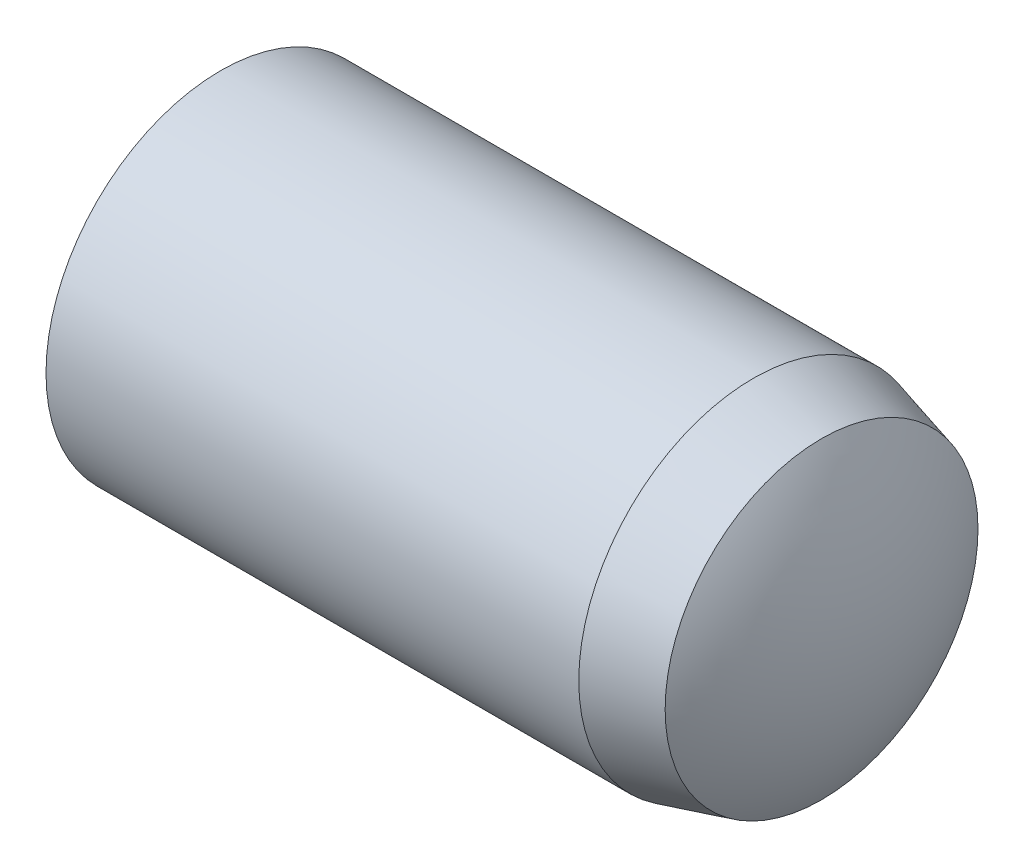
from build123d import *

# Parameters (mm, degrees)
EXTRUDE1_DEPTH      = 3
EXTRUDE1_DEPTH_BACK = 3
SKETCH2_R           = 1.5


with BuildPart() as part:
    # Sketch2 → Extrude1 (new, two sides: drawn at the far end of the back side and taken through both)
    with BuildSketch(Plane(origin=(0, 0, 0), x_dir=(0, 0, -1), z_dir=(1, 0, 0)).offset(-EXTRUDE1_DEPTH_BACK)):
        Circle(SKETCH2_R)
    extrude(amount=EXTRUDE1_DEPTH + EXTRUDE1_DEPTH_BACK)

    # Sketch5 → Cut-Revolve1 (revolve, cut)
    with BuildSketch(Plane.XY, mode=Mode.PRIVATE) as cut_revolve1_sk:
        with BuildLine():
            Line((2.025, 1.5), (2.025, 2))
            Line((2.025, 2), (3.5, 2))
            Line((3.5, 2), (3.5, 0))
            Line((3.5, 0), (3, 0))
            ThreePointArc((3, 0), (2.90052754, 0.699360389), (2.61, 1.343249722))
            Line((2.61, 1.343249722), (2.025, 1.5))
        make_face()
        with BuildLine():
            Line((-2.55, 1.5), (-2.55, 2))
            Line((-2.55, 2), (-3.5, 2))
            Line((-3.5, 2), (-3.5, 0))
            Line((-3.5, 0), (-3, 0))
            ThreePointArc((-3, 0), (-2.885076627, 0.783022988), (-2.55, 1.5))
        make_face()
    revolve(cut_revolve1_sk.sketch.rotate(Axis((-3, 0, 0), (1, 0, 0)), 90), axis=Axis((-3, 0, 0), (1, 0, 0)), mode=Mode.SUBTRACT)


solid = part.part
